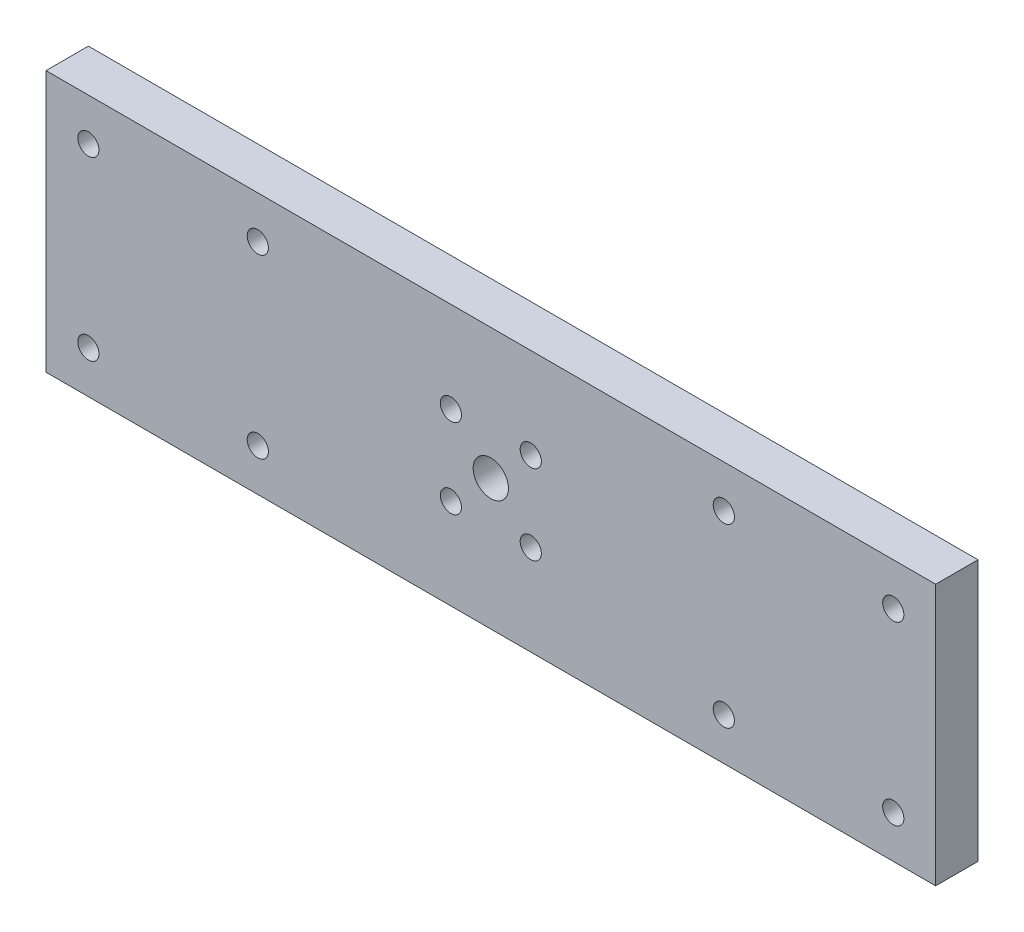
from build123d import *

# Parameters (mm, degrees)
SKETCH_1_W      = 126
SKETCH_1_H      = 37
SKETCH_1_R      = 1.5
SKETCH_1_R_2    = 2.5
EXTRUDE_1_DEPTH = 6


with BuildPart() as part:
    # 草图1 → 凸台-拉伸1 (new body)
    with BuildSketch(Plane.XY):
        Rectangle(SKETCH_1_W, SKETCH_1_H)
        with Locations((-57, 12.5)):
            Circle(SKETCH_1_R, mode=Mode.SUBTRACT)
        with Locations((-33, 12.5)):
            Circle(SKETCH_1_R, mode=Mode.SUBTRACT)
        with Locations((-57, -12.5)):
            Circle(SKETCH_1_R, mode=Mode.SUBTRACT)
        with Locations((-33, -12.5)):
            Circle(SKETCH_1_R, mode=Mode.SUBTRACT)
        with Locations((33, 12.5)):
            Circle(SKETCH_1_R, mode=Mode.SUBTRACT)
        with Locations((57, 12.5)):
            Circle(SKETCH_1_R, mode=Mode.SUBTRACT)
        with Locations((57, -12.5)):
            Circle(SKETCH_1_R, mode=Mode.SUBTRACT)
        with Locations((33, -12.5)):
            Circle(SKETCH_1_R, mode=Mode.SUBTRACT)
        with Locations((-5.656854249, 5.656854249)):
            Circle(SKETCH_1_R, mode=Mode.SUBTRACT)
        with Locations((5.656854249, 5.656854249)):
            Circle(SKETCH_1_R, mode=Mode.SUBTRACT)
        with Locations((-5.656854249, -5.656854249)):
            Circle(SKETCH_1_R, mode=Mode.SUBTRACT)
        with Locations((5.656854249, -5.656854249)):
            Circle(SKETCH_1_R, mode=Mode.SUBTRACT)
        Circle(SKETCH_1_R_2, mode=Mode.SUBTRACT)
    extrude(amount=EXTRUDE_1_DEPTH)


solid = part.part
